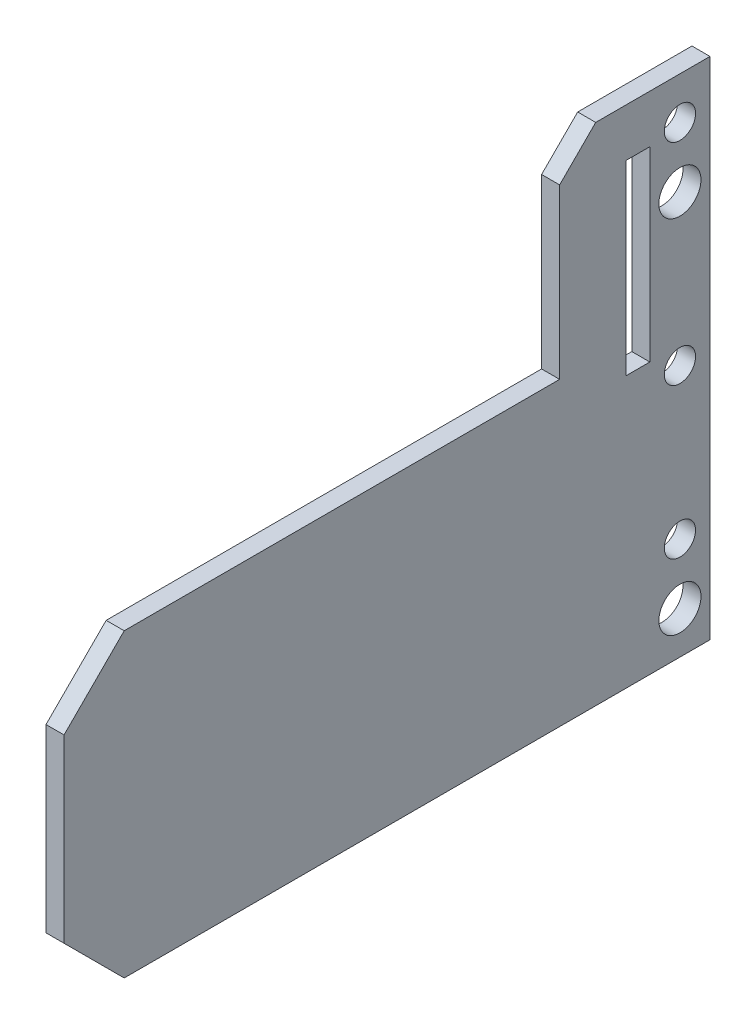
from build123d import *

# Parameters (mm, degrees)
ESQUISSE1_W                            = 53.7
ESQUISSE1_H                            = 42
ESQUISSE1_R                            = 1.75
EXTRUSION1_DEPTH                       = 1.5
FRAISAGE_POUR_VIS_T_TE_FRAIS_E_M2_51_D = 2.59999988
ESQUISSE5_W                            = 2
ESQUISSE5_H                            = 15.5
ENL_V_MAT_EXTRU_1_DEPTH                = 56.35964234
ENL_V_MAT_EXTRU_2_REACH                = 57.36


with BuildPart() as part:
    # Esquisse1 → Extrusion1 (new body)
    with BuildSketch(Plane(origin=(0, 0, 0), x_dir=(0, 0, -1), z_dir=(1, 0, 0))):
        with Locations((-24.35, 0)):
            Rectangle(ESQUISSE1_W, ESQUISSE1_H)
        with Locations((0, -17.5)):
            Circle(ESQUISSE1_R, mode=Mode.SUBTRACT)
        with Locations((0, 12.5)):
            Circle(ESQUISSE1_R, mode=Mode.SUBTRACT)
    extrude(amount=EXTRUSION1_DEPTH)

    # Fraisage pour vis à tête fraisée M2.51 (through all)
    with Locations(Plane(origin=(1.5, 0, 0), x_dir=(0, 0, -1), z_dir=(1, 0, 0))):
        with Locations((0, 17.5), (0, -12.5), (0, 0)):
            Hole(FRAISAGE_POUR_VIS_T_TE_FRAIS_E_M2_51_D / 2)

    # Esquisse5 → Enlèv. mat.-Extru.1 (cut, through all)
    with BuildSketch(Plane.ZY):
        with Locations((3.5, 9.25)):
            Rectangle(ESQUISSE5_W, ESQUISSE5_H)
    extrude(amount=-ENL_V_MAT_EXTRU_1_DEPTH, mode=Mode.SUBTRACT)

    # Esquisse6 → Enlèv. mat.-Extru.2 (cut, up to next)
    with BuildSketch(Plane(origin=(1.5, 0, 0), x_dir=(0, 0, -1), z_dir=(1, 0, 0)), mode=Mode.PRIVATE) as enl_v_mat_extru_2_sk1:
        Polygon((-51.2, 21), (-51.2, -1), (-46.2, 4), (-10, 4), (-10, 18), (-7, 21), align=None)
    enl_v_mat_extru_2_tool1 = extrude(enl_v_mat_extru_2_sk1.sketch, amount=-ENL_V_MAT_EXTRU_2_REACH, mode=Mode.PRIVATE) & part.part
    # Esquisse6 → Enlèv. mat.-Extru.2 (cut, up to next)
    with BuildSketch(Plane(origin=(1.5, 0, 0), x_dir=(0, 0, -1), z_dir=(1, 0, 0)), mode=Mode.PRIVATE) as enl_v_mat_extru_2_sk2:
        Polygon((-51.2, -21), (-46.2, -21), (-51.2, -16), align=None)
    enl_v_mat_extru_2_tool2 = extrude(enl_v_mat_extru_2_sk2.sketch, amount=-ENL_V_MAT_EXTRU_2_REACH, mode=Mode.PRIVATE) & part.part
    add(enl_v_mat_extru_2_tool1.solids().sort_by_distance((1.5, 12.369901, 30.794406))[0], mode=Mode.SUBTRACT)
    add(enl_v_mat_extru_2_tool2.solids().sort_by_distance((1.5, -19.333333, 49.533333))[0], mode=Mode.SUBTRACT)


solid = part.part
